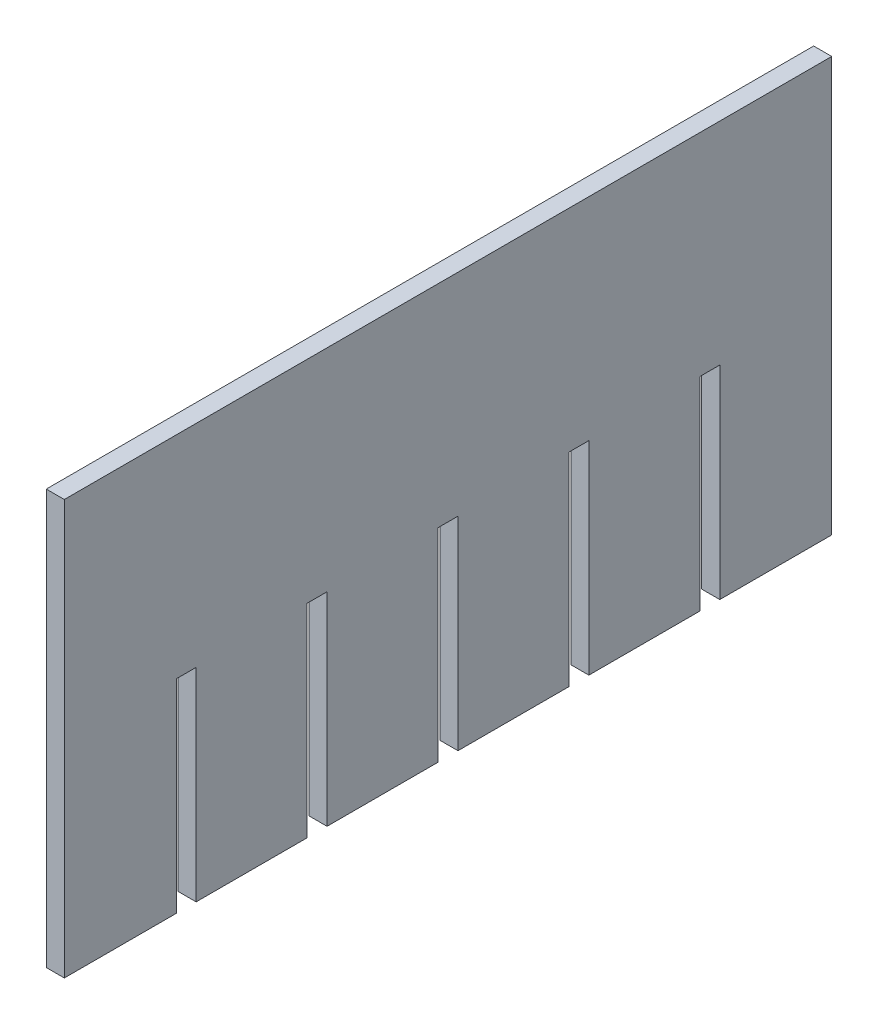
from build123d import *

# Parameters (mm, degrees)
EXTRUDE_1_DEPTH = 4


with BuildPart() as part:
    # Эскиз1 → Бобышка-Вытянуть1 (new body)
    with BuildSketch(Plane(origin=(0, 0, 0), x_dir=(0, 0, -1), z_dir=(1, 0, 0))):
        Polygon((0, 0), (0, 91.8), (170, 91.8), (170, 0), (145.2, 0), (145.2, 45), (140.8, 45), (140.8, 0), (116.2, 0), (116.2, 45), (111.8, 45), (111.8, 0), (87.2, 0), (87.2, 45), (82.8, 45), (82.8, 0), (58.2, 0), (58.2, 45), (53.8, 45), (53.8, 0), (29.2, 0), (29.2, 45), (24.8, 45), (24.8, 0), align=None)
    extrude(amount=EXTRUDE_1_DEPTH)


solid = part.part
